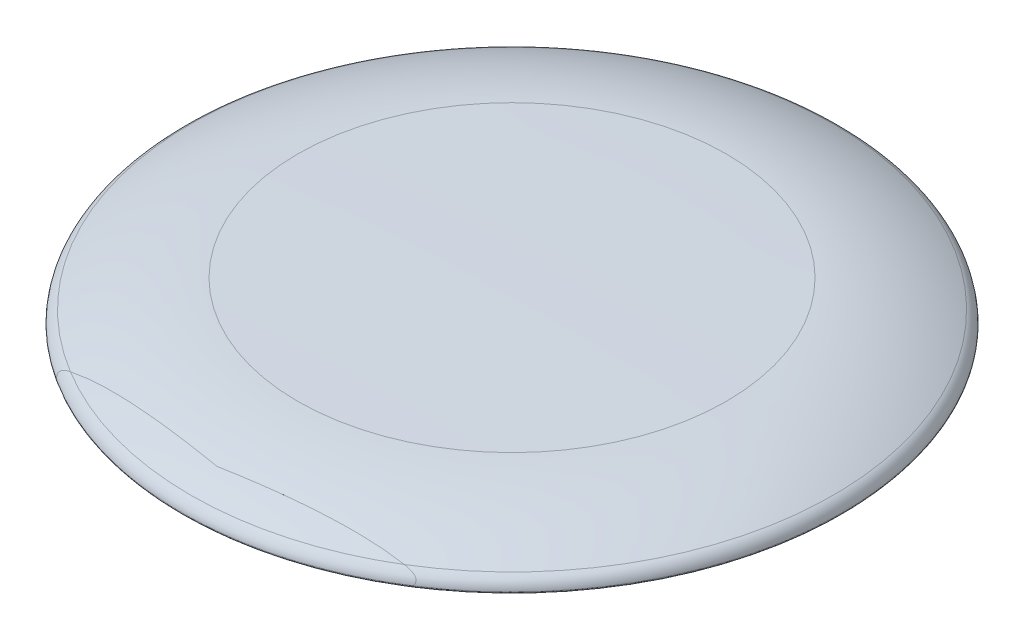
from build123d import *

# Parameters (mm, degrees)
FILLET1_R                = 0.508
SURFACE_EXTRUDE1_1_BACK  = 127
SURFACE_EXTRUDE1_1_DEPTH = 254
SURFACE_EXTRUDE1_2_BACK  = 127
SURFACE_EXTRUDE1_2_DEPTH = 254


with BuildPart() as part:
    # Sketch1 → Revolve1 (revolve)
    with BuildSketch(Plane(origin=(0, 0, 0), x_dir=(0, 0, -1), z_dir=(1, 0, 0)), mode=Mode.PRIVATE) as revolve1_sk:
        with BuildLine():
            ThreePointArc((-12.826997294, 6.917917929), (-40.504520052, 6.5403415), (-68.173922296, 5.77091996))
            ThreePointArc((-68.173922296, 5.77091996), (-74.816188883, 5.258583254), (-81.391835503, 4.189440674))
            ThreePointArc((-81.391835503, 4.189440674), (-81.828705787, 3.924494007), (-82, 3.443130659))
            Line((-82, 3.443130659), (-82, -9.5))
            ThreePointArc((-82, -9.5), (-93.285131496, -6.081064837), (-105, -4.7375))
            ThreePointArc((-105, -4.7375), (-104.296417694, -2.246196445), (-102.393556576, -0.490992459))
            ThreePointArc((-102.393556576, -0.490992459), (-85.808363543, 5.772107771), (-68.2625, 8.309375))
            ThreePointArc((-68.2625, 8.309375), (-34.136441284, 9.202321115), (0, 9.5))
            Line((0, 9.5), (0, 7.084421719))
            Line((0, 7.084421719), (-3.175, 7.084421719))
            Line((-3.175, 7.084421719), (-3.175, 6.957421719))
            ThreePointArc((-3.175, 6.957421719), (-7.874024074, 6.944142392), (-12.573002654, 6.919568027))
            ThreePointArc((-12.573002654, 6.919568027), (-12.699174951, 6.791749784), (-12.826997294, 6.917917929))
        make_face()
    revolve(revolve1_sk.sketch.rotate(Axis((0, 0, 0), (0, 1, 0)), 180), axis=Axis((0, 0, 0), (0, 1, 0)))

    # Fillet1
    fillet1_edges = [part.edges().sort_by_distance(p)[0] for p in [
        (0, -9.5, 82),
        (0, -4.7375, 105),
    ]]
    fillet(fillet1_edges, radius=FILLET1_R)


with BuildPart() as body_2:
    # Split1: the piece behind the surface
    add(part.part)
    # Surface-Extrude1: a surface, the sketch's curves swept straight by 254 mm
    with BuildLine(Plane(origin=(0, 0, 0), x_dir=(0, 0, -1), z_dir=(1, 0, 0)).offset(-SURFACE_EXTRUDE1_1_BACK), mode=Mode.PRIVATE) as surface_extrude1_1_path:
        ThreePointArc((-93.253846406, -6.087550836), (-87.430895176, -0.968460031), (-93.963415931, 3.207426016))
        ThreePointArc((-93.963415931, 3.207426016), (-98.230628804, 1.477070024), (-102.393556576, -0.490992459))
        ThreePointArc((-102.393556576, -0.490992459), (-104.144964964, -2.014794763), (-104.967907532, -4.185548165))
        ThreePointArc((-104.967907532, -4.185548165), (-104.848163503, -4.576036863), (-104.479652405, -4.752160758))
        ThreePointArc((-104.479652405, -4.752160758), (-98.837931857, -5.177604325), (-93.253846406, -6.087550836))
    surface_extrude1_1 = Shell.extrude(surface_extrude1_1_path.wire(), (1 * SURFACE_EXTRUDE1_1_DEPTH, 0 * SURFACE_EXTRUDE1_1_DEPTH, 0 * SURFACE_EXTRUDE1_1_DEPTH))
    split(bisect_by=surface_extrude1_1, keep=Keep.BOTTOM)


with BuildPart() as part_1:
    add(part.part)

    # Split1: split by a surface, the side it looks to stays
    # Surface-Extrude1: a surface, the sketch's curves swept straight by 254 mm
    with BuildLine(Plane(origin=(0, 0, 0), x_dir=(0, 0, -1), z_dir=(1, 0, 0)).offset(-SURFACE_EXTRUDE1_2_BACK), mode=Mode.PRIVATE) as surface_extrude1_2_path:
        ThreePointArc((-93.253846406, -6.087550836), (-87.430895176, -0.968460031), (-93.963415931, 3.207426016))
        ThreePointArc((-93.963415931, 3.207426016), (-98.230628804, 1.477070024), (-102.393556576, -0.490992459))
        ThreePointArc((-102.393556576, -0.490992459), (-104.144964964, -2.014794763), (-104.967907532, -4.185548165))
        ThreePointArc((-104.967907532, -4.185548165), (-104.848163503, -4.576036863), (-104.479652405, -4.752160758))
        ThreePointArc((-104.479652405, -4.752160758), (-98.837931857, -5.177604325), (-93.253846406, -6.087550836))
    surface_extrude1_2 = Shell.extrude(surface_extrude1_2_path.wire(), (1 * SURFACE_EXTRUDE1_2_DEPTH, 0 * SURFACE_EXTRUDE1_2_DEPTH, 0 * SURFACE_EXTRUDE1_2_DEPTH))
    split(bisect_by=surface_extrude1_2, keep=Keep.TOP)


solid = Compound([body_2.part, part_1.part])
